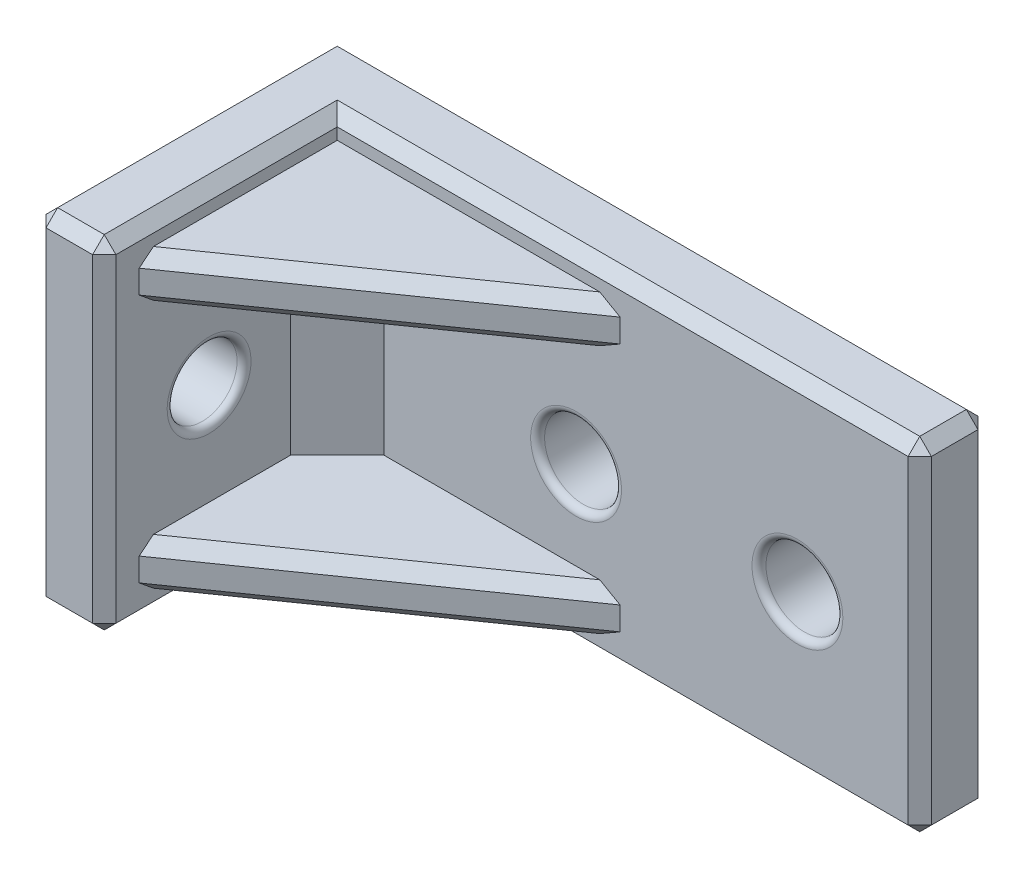
from build123d import *

# Parameters (mm, degrees)
ESBO_O2_W                = 28
ESBO_O2_H                = 14.7
ESBO_O2_R                = 1.65
RESSALTO_EXTRUS_O1_DEPTH = 3
ESBO_O3_W                = 3
ESBO_O3_H                = 14.7
RESSALTO_EXTRUS_O2_DEPTH = 10
ESBO_O4_R                = 1.5
CORTE_EXTRUS_O1_DEPTH    = 10
FILETE1_R                = 0.3
RESSALTO_EXTRUS_O3_DEPTH = 2
RESSALTO_EXTRUS_O4_DEPTH = 2
CHANFRO4_SIZE            = 0.5
CHANFRO6_SIZE            = 2


with BuildPart() as part:
    # Esboço2 → Ressalto-extrusão1 (new body)
    with BuildSketch(Plane.XY):
        with Locations((-4, -2)):
            Rectangle(ESBO_O2_W, ESBO_O2_H)
        with Locations((-4.75, -2.55)):
            Circle(ESBO_O2_R, mode=Mode.SUBTRACT)
        with Locations((4.75, -2.55)):
            Circle(ESBO_O2_R, mode=Mode.SUBTRACT)
    extrude(amount=RESSALTO_EXTRUS_O1_DEPTH)

    # Esboço3 → Ressalto-extrusão2 (add)
    with BuildSketch(Plane.XY.offset(3)):
        with Locations((-16.5, -2)):
            Rectangle(ESBO_O3_W, ESBO_O3_H)
    extrude(amount=RESSALTO_EXTRUS_O2_DEPTH)

    # Esboço4 → Corte-extrusão1 (cut)
    with BuildSketch(Plane(origin=(-15, 0, 0), x_dir=(0, 0, -1), z_dir=(1, 0, 0))):
        with Locations(Location((-8.5, -2, 0), (0, 0, 90))):
            Circle(ESBO_O4_R)
    extrude(amount=-CORTE_EXTRUS_O1_DEPTH, mode=Mode.SUBTRACT)

    # Filete1
    filete1_edges = [part.edges().sort_by_distance(p)[0] for p in [
        (-6.4, -2.55, 0),
        (-6.4, -2.55, 3),
        (3.1, -2.55, 0),
        (3.1, -2.55, 3),
        (-18, -3.5, 8.5),
        (-15, -3.5, 8.5),
    ]]
    fillet(filete1_edges, radius=FILETE1_R)

    # Esboço5 → Ressalto-extrusão3 (add)
    with BuildSketch(Plane(origin=(0, 4.35, 0), x_dir=(1, 0, 0), z_dir=(0, 1, 0))):
        Polygon((-15, -3), (-2.860741943, -3), (-15, -11.5), align=None)
    extrude(amount=-RESSALTO_EXTRUS_O3_DEPTH)

    # Esboço7 → Ressalto-extrusão4 (add)
    with BuildSketch(Plane(origin=(0, -8.35, 0), x_dir=(-1, 0, 0), z_dir=(0, -1, 0))):
        Polygon((15, -11.5), (15, -3), (2.860741943, -3), align=None)
    extrude(amount=-RESSALTO_EXTRUS_O4_DEPTH)

    # Chanfro4
    chanfro4_edges = [part.edges().sort_by_distance(p)[0] for p in [
        (-2.5, -9.35, 3),
        (-15, -9.35, 8),
        (-15, 5.35, 8),
        (-18, -2, 13),
        (-16.5, -9.35, 13),
        (-15, -2, 13),
        (-16.5, 5.35, 13),
        (10, -2, 3),
        (-4, -9.35, 0),
        (-4, 5.35, 0),
        (10, -2, 0),
        (-8.930370971, 2.35, 7.25),
        (-8.930370971, 4.35, 7.25),
        (-8.930370971, -6.35, 7.25),
        (-8.930370971, -8.35, 7.25),
        (10, -9.35, 1.5),
        (-18, -9.35, 6.5),
        (-18, 5.35, 6.5),
        (10, 5.35, 1.5),
        (-2.5, 5.35, 3),
    ]]
    chamfer(chanfro4_edges, length=CHANFRO4_SIZE)

    # Chanfro6
    chanfro6_edges = [part.edges().sort_by_distance(p)[0] for p in [
        (-15, -2, 3),
    ]]
    chamfer(chanfro6_edges, length=CHANFRO6_SIZE)


solid = part.part
